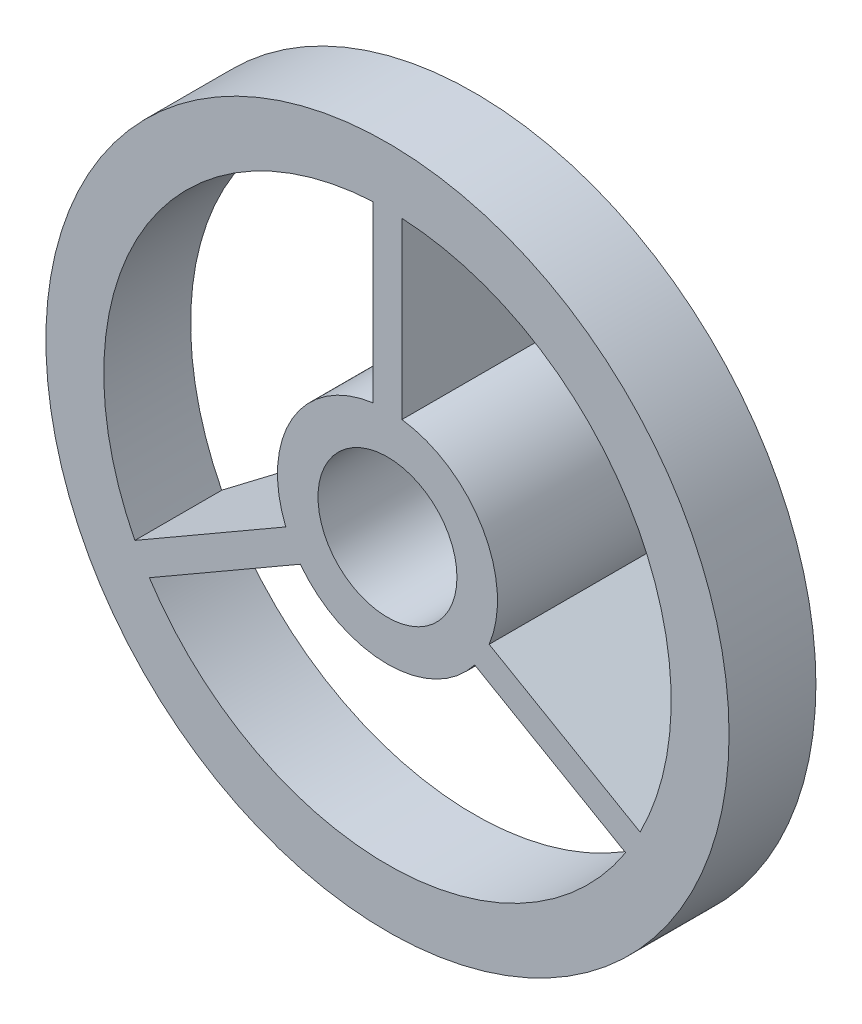
from build123d import *

# Parameters (mm, degrees)
SKETCH1_R           = 1.9
SKETCH1_R_2         = 1.2
BOSS_EXTRUDE1_DEPTH = 3.5
SKETCH2_R           = 5.9
SKETCH2_R_2         = 4.9
BOSS_EXTRUDE2_DEPTH = 1.5
BOSS_EXTRUDE3_DEPTH = 0.25
CIRPATTERN1_COUNT   = 3


with BuildPart() as part:
    # Sketch1 → Boss-Extrude1 (new body)
    with BuildSketch(Plane.XY):
        Circle(SKETCH1_R)
        Circle(SKETCH1_R_2, mode=Mode.SUBTRACT)
    extrude(amount=BOSS_EXTRUDE1_DEPTH)



with BuildPart() as body_2:
    # Sketch2 → Boss-Extrude2 (new body)
    with BuildSketch(Plane.XY.offset(3.5)):
        Circle(SKETCH2_R)
        Circle(SKETCH2_R_2, mode=Mode.SUBTRACT)
    extrude(amount=-BOSS_EXTRUDE2_DEPTH)


with BuildPart() as part_1:
    add(part.part)

    add(body_2.part)  # Boss-Extrude3 merges body 2
    # Sketch5 → Boss-Extrude3 (add, symmetric)
    with BuildSketch(Plane(origin=(0, 0, 0), x_dir=(0, 0, -1), z_dir=(1, 0, 0))):
        Polygon((0, 1.899997994), (-2, 4.9), (-3.5, 4.9), (-3.5, 1.899997994), (-3.5, 1.699997994), (0, 1.699997994), align=None)
    boss_extrude3 = extrude(amount=BOSS_EXTRUDE3_DEPTH, both=True)

    # CirPattern1: Boss-Extrude3 ×3 about axis
    cirpattern1_axis = Axis((0, 0, 0), (0, 0, 1))
    for i in range(1, CIRPATTERN1_COUNT):
        add(boss_extrude3.rotate(cirpattern1_axis, i * 360 / CIRPATTERN1_COUNT))


solid = part_1.part
